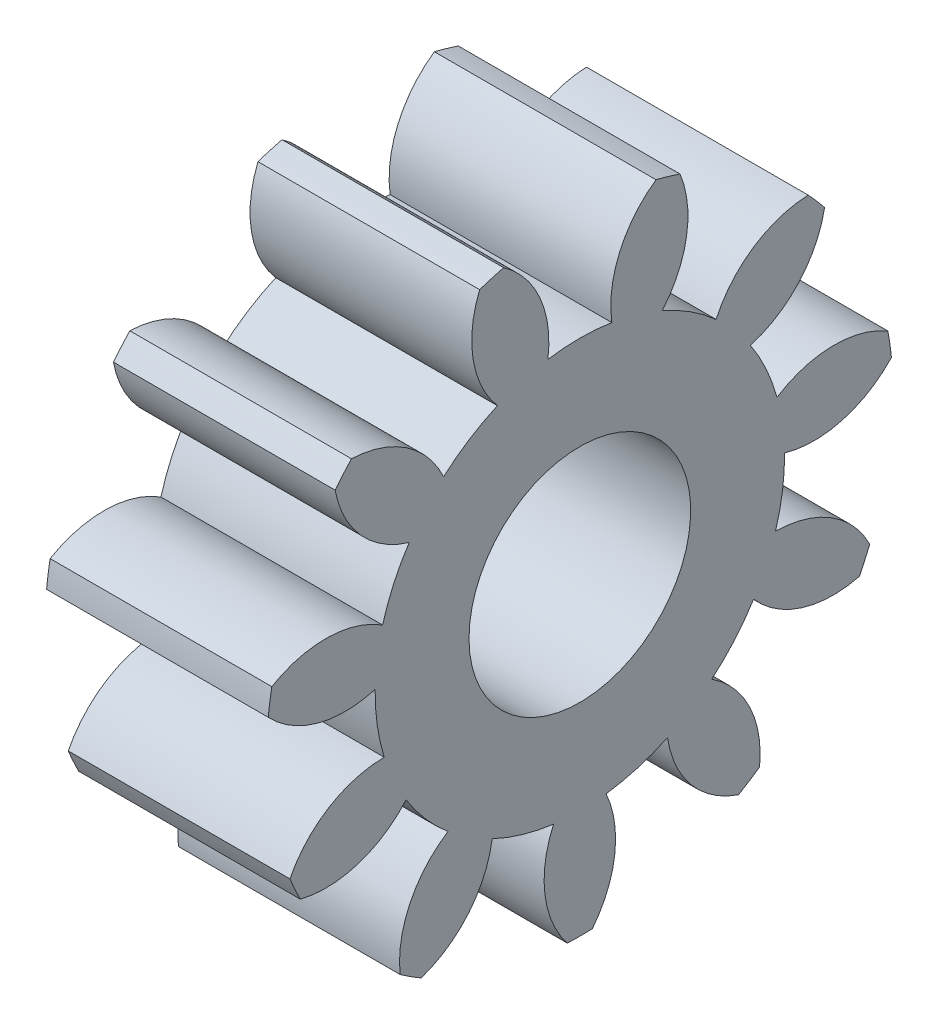
from build123d import *

# Parameters (mm, degrees)
BASPROSKE_W     = 2.3
BASPROSKE_H     = 3.25
TOOTHCUT_DEPTH  = 6.13955251
TEETHCUTS_COUNT = 11
BORSKE_R        = 1.15
BORE_DEPTH      = 50.000508


with BuildPart() as part:
    # BasProSke → Base-Revolve (revolve)
    with BuildSketch(Plane(origin=(0, 0, 0), x_dir=(1, 0, 0), z_dir=(0, 1, 0)), mode=Mode.PRIVATE) as base_revolve_sk:
        with Locations((1.15, 1.625)):
            Rectangle(BASPROSKE_W, BASPROSKE_H)
    revolve(base_revolve_sk.sketch.rotate(Axis((-10, 0, 0), (1, 0, 0)), 180), axis=Axis((-10, 0, 0), (1, 0, 0)))

    # TooCutSke → ToothCut (cut, through all)
    with BuildSketch(Plane(origin=(0, 0, 0), x_dir=(0, 0, -1), z_dir=(1, 0, 0))):
        with BuildLine():
            ThreePointArc((0.331902335, 2.097907729), (0, 2.124), (-0.331902335, 2.097907729))
            ThreePointArc((-0.331902335, 2.097907729), (-0.419191164, 2.705367497), (-0.818348933, 3.171521746))
            ThreePointArc((-0.818348933, 3.171521746), (0, 3.2754), (0.818348933, 3.171521746))
            ThreePointArc((0.818348933, 3.171521746), (0.419191164, 2.705367497), (0.331902335, 2.097907729))
        make_face()
    toothcut = extrude(amount=TOOTHCUT_DEPTH, mode=Mode.SUBTRACT)

    # TeethCuts: ToothCut ×11 about axis
    teethcuts_axis = Axis((0, 0, 0), (1, 0, 0))
    for i in range(1, TEETHCUTS_COUNT):
        add(toothcut.rotate(teethcuts_axis, i * 360 / TEETHCUTS_COUNT), mode=Mode.SUBTRACT)

    # BorSke → Bore (cut, symmetric)
    with BuildSketch(Plane(origin=(0, 0, 0), x_dir=(0, 0, -1), z_dir=(1, 0, 0))):
        with Locations(Location((0, 0, 0), (0, 0, 180))):
            Circle(BORSKE_R)
    extrude(amount=BORE_DEPTH, both=True, mode=Mode.SUBTRACT)


solid = part.part
